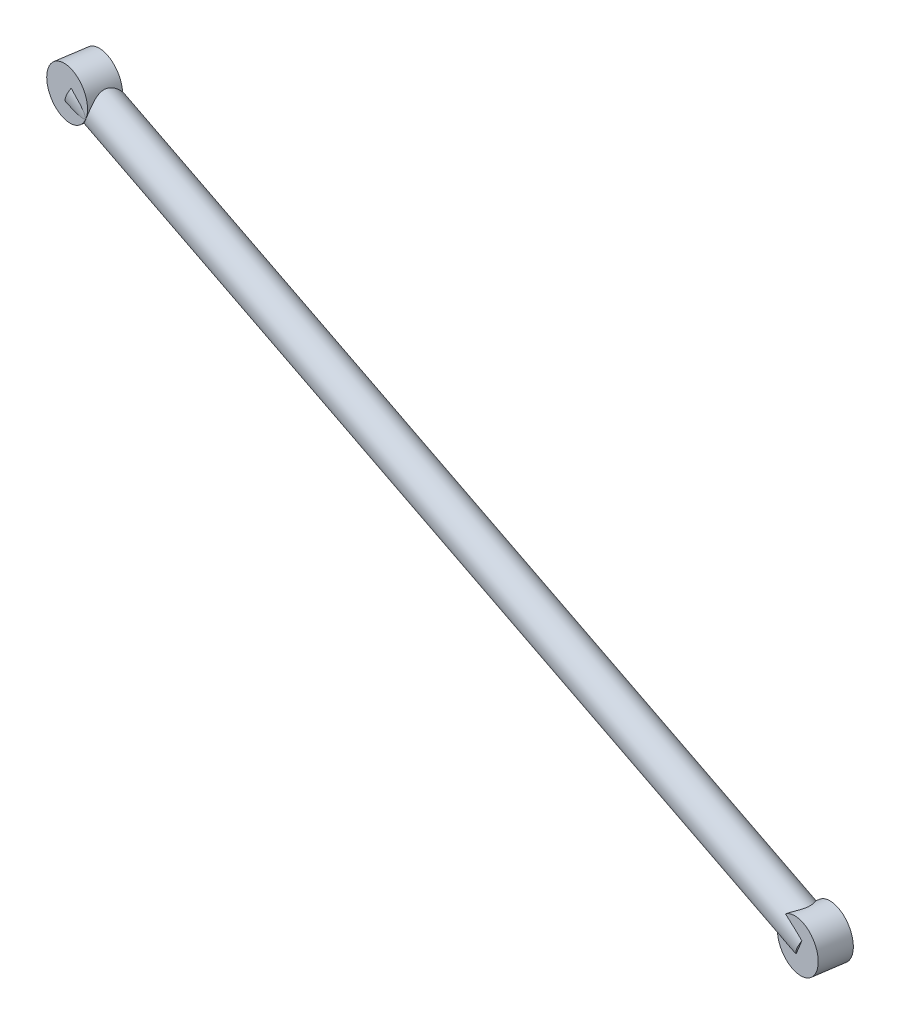
from build123d import *

# Parameters (mm, degrees)
SUSP_RL_TOE_LINK_PROFILE_R             = 8
SUSP_RL_TOE_LINK_ROD_END_IN_PROFILE_R  = 11
SUSP_RL_TOE_LINK_ROD_END_OUT_PROFILE_R = 11


with BuildPart() as part:
    # SUSP_RL_toe_link: sweep along a curve in space
    with BuildLine() as susp_rl_toe_link_path:
        Line((-175, 1319.6, -94), (-520.81, 1474.2, -108.53))
    # SUSP_RL_toe_link profile (on start of the path) → SUSP_RL_toe_link (sweep)
    with BuildSketch(Plane(origin=(-175, 1319.6, -94), x_dir=(-0.40813623590833575, -0.9129210332436072, 0), z_dir=(-0.9122501501575765, 0.4078363066839052, -0.03833028160489745))):
        Circle(SUSP_RL_TOE_LINK_PROFILE_R)
    sweep(path=susp_rl_toe_link_path.line)

    # SUSP_RL_toe_link_rod_end_in: sweep along a curve in space
    with BuildLine() as susp_rl_toe_link_rod_end_in_path:
        Line((-176.034666, 1319.6, -87.076889), (-173.965334, 1319.6, -100.923111))
    # SUSP_RL_toe_link_rod_end_in profile (on start of the path) → SUSP_RL_toe_link_rod_end_in (sweep)
    with BuildSketch(Plane(origin=(-176.034666, 1319.6, -87.076889), x_dir=(-0.989015860676298, 0, -0.14780942909950529), z_dir=(0.14780942909950529, 0, -0.989015860676298))):
        Circle(SUSP_RL_TOE_LINK_ROD_END_IN_PROFILE_R)
    sweep(path=susp_rl_toe_link_rod_end_in_path.line)

    # SUSP_RL_toe_link_rod_end_out: sweep along a curve in space
    with BuildLine() as susp_rl_toe_link_rod_end_out_path:
        Line((-521.844666, 1474.2, -101.606889), (-519.775334, 1474.2, -115.453111))
    # SUSP_RL_toe_link_rod_end_out profile (on start of the path) → SUSP_RL_toe_link_rod_end_out (sweep)
    with BuildSketch(Plane(origin=(-521.844666, 1474.2, -101.606889), x_dir=(-0.9890158606762977, 0, -0.14780942909950728), z_dir=(0.14780942909950728, 0, -0.9890158606762977))):
        Circle(SUSP_RL_TOE_LINK_ROD_END_OUT_PROFILE_R)
    sweep(path=susp_rl_toe_link_rod_end_out_path.line)


solid = part.part
